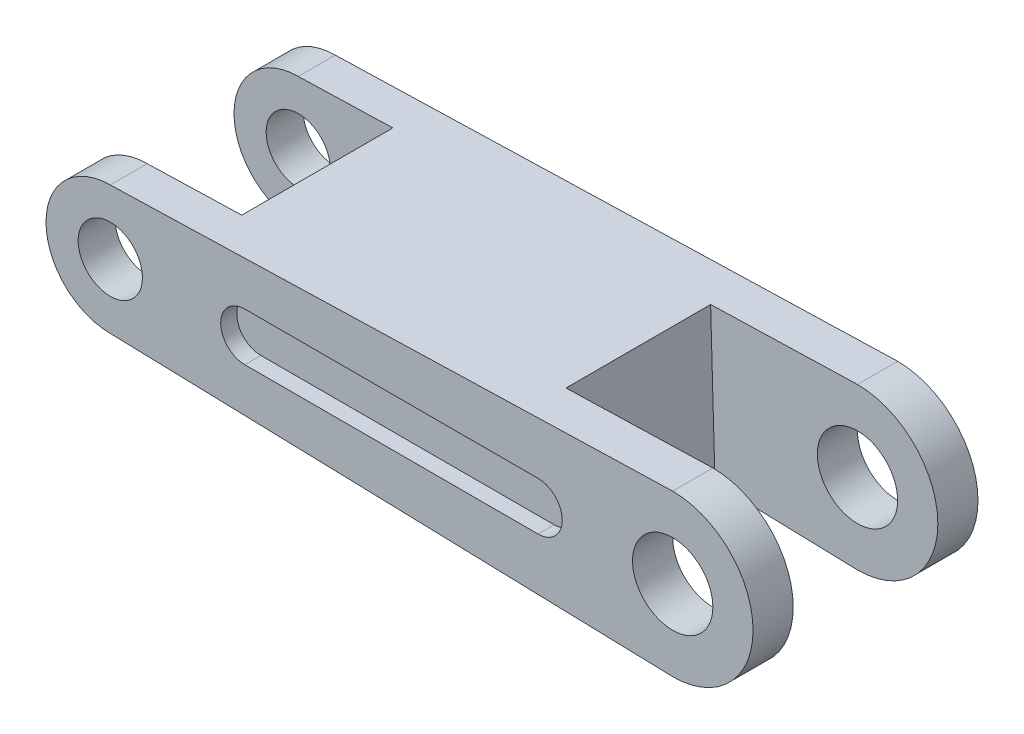
from build123d import *

# Parameters (mm, degrees)
SKETCH1_R           = 20
SKETCH1_R_2         = 25
BOSS_EXTRUDE1_DEPTH = 70
SKETCH2_W           = 100
SKETCH2_H           = 94
SKETCH2_W_2         = 140
SKETCH2_H_2         = 90
CUT_EXTRUDE1_DEPTH  = 256.191648227
SKETCH3_W           = 2.284781912
SKETCH3_H           = 94
CUT_EXTRUDE4_DEPTH  = 45
CUT_EXTRUDE5_DEPTH  = 10


with BuildPart() as part:
    # Sketch1 → Boss-Extrude1 (new, symmetric)
    with BuildSketch(Plane.XY):
        with BuildLine():
            Line((172.145187602, 49.918433931), (-175, 40))
            ThreePointArc((-175, 40), (-215, 0), (-175, -40))
            Line((-175, -40), (172.145187602, -49.918433931))
            Line((172.145187602, -49.918433931), (175, -50))
            ThreePointArc((175, -50), (225, 0), (175, 50))
            Line((175, 50), (172.145187602, 49.918433931))
        make_face()
        with Locations((-175, 0)):
            Circle(SKETCH1_R, mode=Mode.SUBTRACT)
        with Locations((175, 0)):
            Circle(SKETCH1_R_2, mode=Mode.SUBTRACT)
    extrude(amount=BOSS_EXTRUDE1_DEPTH, both=True)

    # Sketch2 → Cut-Extrude1 (cut, through all)
    with BuildSketch(Plane(origin=(-1.284665579, 44.963295269, 0), x_dir=(0.9995920864606948, 0.028559773898877126, 0), z_dir=(-0.02855977389887713, 0.9995920864606949, 0))):
        with Locations((-164.928615131, 0)):
            Rectangle(SKETCH2_W, SKETCH2_H)
        with Locations((154.928615131, 0)):
            Rectangle(SKETCH2_W_2, SKETCH2_H_2)
    extrude(amount=-CUT_EXTRUDE1_DEPTH, mode=Mode.SUBTRACT)

    # Sketch3 → Cut-Extrude4 (cut, symmetric)
    with BuildSketch(Plane(origin=(-1.284665579, 44.963295269, 0), x_dir=(0.9995920864606948, 0.02855977389887712, 0), z_dir=(-0.028559773898877122, 0.9995920864606949, 0))):
        with Locations((-174.928615131, 0)):
            Rectangle(SKETCH3_W, SKETCH3_H)
    extrude(amount=CUT_EXTRUDE4_DEPTH, both=True, mode=Mode.SUBTRACT)

    # Sketch4 → Cut-Extrude5 (cut)
    with BuildSketch(Plane.XY.offset(70)):
        with BuildLine():
            Line((-91.281137221, 15), (91.281137221, 15))
            ThreePointArc((91.281137221, 15), (106.281137221, 0), (91.281137221, -15))
            Line((91.281137221, -15), (-91.281137221, -15))
            ThreePointArc((-91.281137221, -15), (-106.281137221, 0), (-91.281137221, 15))
        make_face()
    cut_extrude5 = extrude(amount=-CUT_EXTRUDE5_DEPTH, mode=Mode.SUBTRACT)

    # Mirror1: Cut-Extrude5 across plane
    add(cut_extrude5.mirror(Plane.XY), mode=Mode.SUBTRACT)


solid = part.part
